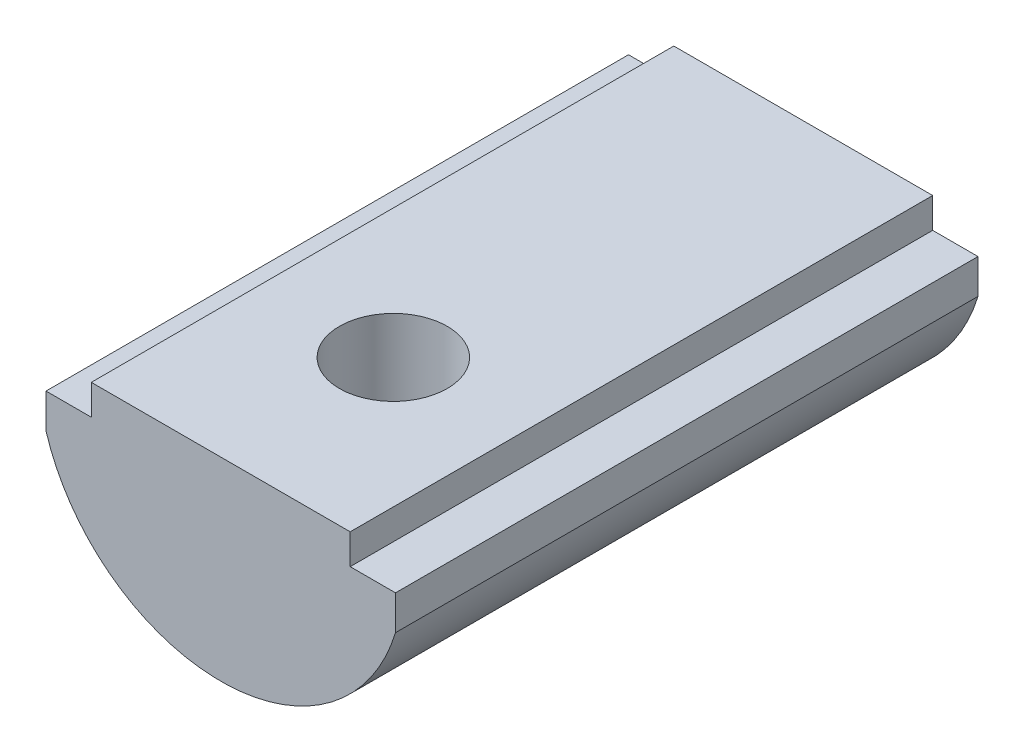
from build123d import *

# Parameters (mm, degrees)
BOSS_EXTRU_1_DEPTH                        = 13.5
TROU_POUR_TARAUDAGE_POUR_TROU_TARAUD_M3_D = 2.5


with BuildPart() as part:
    # Esquisse1 → Boss.-Extru.1 (new body)
    with BuildSketch(Plane.XY):
        with BuildLine():
            Line((-3, 0), (3, 0))
            Line((3, 0), (3, -0.7))
            Line((3, -0.7), (4.05, -0.7))
            Line((4.05, -0.7), (4.05, -1.5))
            ThreePointArc((4.05, -1.5), (0, -4.5), (-4.05, -1.5))
            Line((-4.05, -1.5), (-4.05, -0.7))
            Line((-4.05, -0.7), (-3, -0.7))
            Line((-3, -0.7), (-3, 0))
        make_face()
    extrude(amount=BOSS_EXTRU_1_DEPTH)

    # Trou pour taraudage pour trou taraudé M31 (through all)
    with Locations(Plane(origin=(0, 0, 0), x_dir=(1, 0, 0), z_dir=(0, 1, 0))):
        with Locations((0, -9.5)):
            Hole(TROU_POUR_TARAUDAGE_POUR_TROU_TARAUD_M3_D / 2)

    # Esquisse4 → Révolution1 (revolve)
    with BuildSketch(Plane(origin=(0, 0, 0), x_dir=(0, 0, -1), z_dir=(1, 0, 0))):
        with BuildLine():
            Line((-3, -3.3), (-3, -5.3))
            ThreePointArc((-3, -5.3), (-2, -4.3), (-3, -3.3))
        make_face()
    revolve(axis=Axis((0, -3.3, 3), (0, -1, 0)))


solid = part.part
